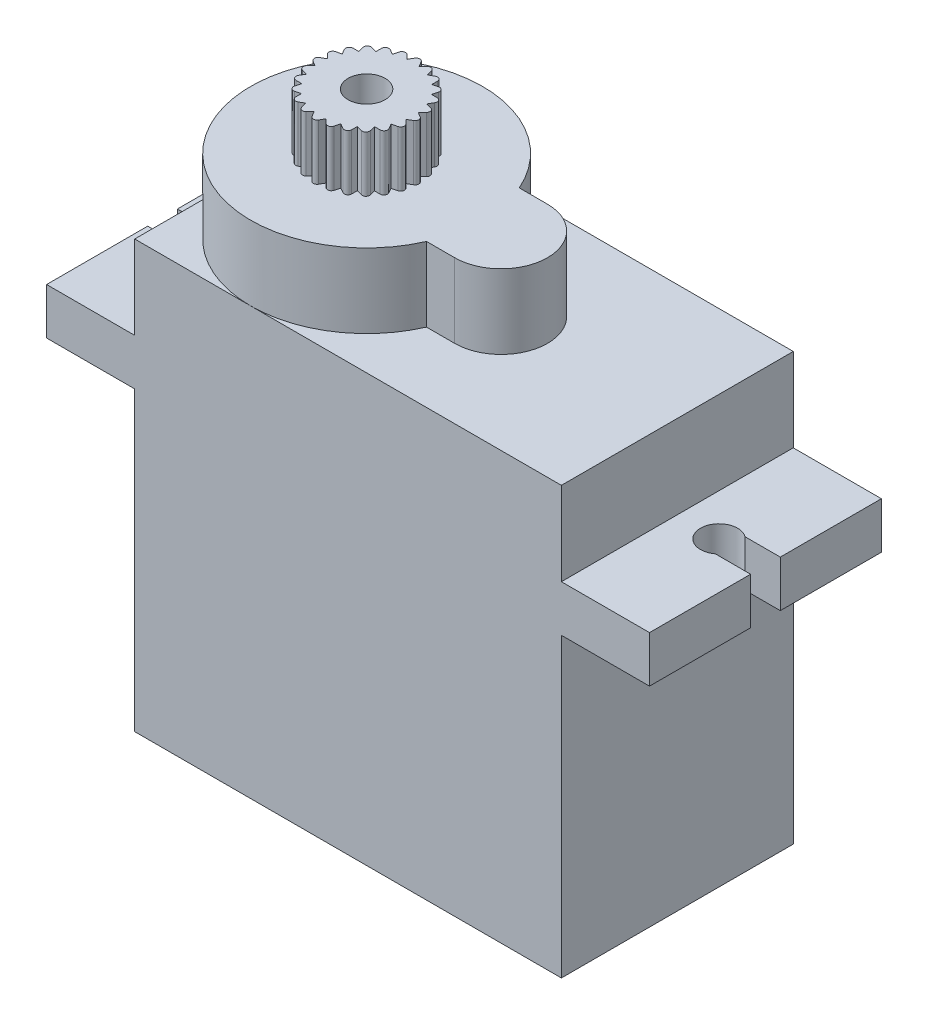
from build123d import *

# Parameters (mm, degrees)
RESSALTO_EXTRUS_O1_DEPTH = 12.5
CORTE_EXTRUS_O1_DEPTH    = 36.616885041
ESBO_O3_R                = 6.25
ESBO_O3_R_2              = 2.5
RESSALTO_EXTRUS_O3_DEPTH = 4
ESBO_O4_R                = 2.5
ESBO_O4_R_2              = 1
RESSALTO_EXTRUS_O4_DEPTH = 3
RESSALTO_EXTRUS_O5_DEPTH = 3
PADR_OCIRCULAR1_COUNT    = 24


with BuildPart() as part:
    # Esboço1 → Ressalto-extrusão1 (new body)
    with BuildSketch(Plane.XY):
        Polygon((0, 0), (0, 16), (-4.75, 16), (-4.75, 18.5), (0, 18.5), (0, 23), (23, 23), (23, 18.5), (27.75, 18.5), (27.75, 16), (23, 16), (23, 0), align=None)
    extrude(amount=RESSALTO_EXTRUS_O1_DEPTH)

    # Esboço2 → Corte-extrusão1 (cut, through all)
    with BuildSketch(Plane(origin=(0, 18.5, 0), x_dir=(1, 0, 0), z_dir=(0, 1, 0))):
        with BuildLine():
            ThreePointArc((-2.85, -7.05), (-3.25, -6.25), (-2.85, -5.45))
            Line((-2.85, -5.45), (-4.75, -5.45))
            Line((-4.75, -5.45), (-4.75, -7.05))
            Line((-4.75, -7.05), (-2.85, -7.05))
        make_face()
        with BuildLine():
            ThreePointArc((-1.25, -6.25), (-1.802786405, -5.355572809), (-2.85, -5.45))
            Line((-2.85, -5.45), (-2.85, -7.05))
            ThreePointArc((-2.85, -7.05), (-1.802786405, -7.144427191), (-1.25, -6.25))
        make_face()
        with BuildLine():
            Line((-2.85, -7.05), (-2.85, -5.45))
            ThreePointArc((-2.85, -5.45), (-3.25, -6.25), (-2.85, -7.05))
        make_face()
        with BuildLine():
            ThreePointArc((26.25, -6.25), (26.144427191, -5.802786405), (25.85, -5.45))
            Line((25.85, -5.45), (25.85, -7.05))
            ThreePointArc((25.85, -7.05), (26.144427191, -6.697213595), (26.25, -6.25))
        make_face()
        with BuildLine():
            Line((25.85, -7.05), (25.85, -5.45))
            ThreePointArc((25.85, -5.45), (24.25, -6.25), (25.85, -7.05))
        make_face()
        with BuildLine():
            Line((27.75, -5.45), (25.85, -5.45))
            ThreePointArc((25.85, -5.45), (26.144427191, -5.802786405), (26.25, -6.25))
            ThreePointArc((26.25, -6.25), (26.144427191, -6.697213595), (25.85, -7.05))
            Line((25.85, -7.05), (27.75, -7.05))
            Line((27.75, -7.05), (27.75, -5.45))
        make_face()
    extrude(amount=-CORTE_EXTRUS_O1_DEPTH, mode=Mode.SUBTRACT)

    # Esboço3 → Ressalto-extrusão3 (add)
    with BuildSketch(Plane(origin=(0, 23, 0), x_dir=(1, 0, 0), z_dir=(0, 1, 0))):
        with BuildLine():
            ThreePointArc((12.137931034, -4.153629772), (12.789692169, -3.8530305), (13.5, -3.75))
            Line((13.5, -3.75), (11.978219619, -3.75))
            ThreePointArc((11.978219619, -3.75), (12.061580529, -3.95042792), (12.137931034, -4.153629772))
        make_face()
        with BuildLine():
            Line((11.978219619, -8.75), (13.5, -8.75))
            ThreePointArc((13.5, -8.75), (12.789692169, -8.6469695), (12.137931034, -8.346370228))
            ThreePointArc((12.137931034, -8.346370228), (12.061580529, -8.54957208), (11.978219619, -8.75))
        make_face()
        with BuildLine():
            ThreePointArc((12.137931034, -8.346370228), (12.789692169, -8.6469695), (13.5, -8.75))
            Line((13.5, -8.75), (13.5, -3.75))
            ThreePointArc((13.5, -3.75), (12.789692169, -3.8530305), (12.137931034, -4.153629772))
            ThreePointArc((12.137931034, -4.153629772), (12.408817621, -5.186296321), (12.5, -6.25))
            ThreePointArc((12.5, -6.25), (12.408817621, -7.313703679), (12.137931034, -8.346370228))
        make_face()
        with BuildLine():
            Line((13.5, -3.75), (13.5, -8.75))
            ThreePointArc((13.5, -8.75), (15.267766953, -8.017766953), (16, -6.25))
            ThreePointArc((16, -6.25), (15.267766953, -4.482233047), (13.5, -3.75))
        make_face()
        with Locations((6.25, -6.25)):
            Circle(ESBO_O3_R)
        with Locations((13.5, -6.25)):
            Circle(ESBO_O3_R_2)
        with BuildLine():
            Line((8.733610526, -8.75), (11.978219619, -8.75))
            ThreePointArc((11.978219619, -8.75), (12.061580529, -8.54957208), (12.137931034, -8.346370228))
            ThreePointArc((12.137931034, -8.346370228), (11, -6.25), (12.137931034, -4.153629772))
            ThreePointArc((12.137931034, -4.153629772), (12.061580529, -3.95042792), (11.978219619, -3.75))
            Line((11.978219619, -3.75), (8.733610526, -3.75))
            Line((8.733610526, -3.75), (8.733610526, -8.75))
        make_face()
        with BuildLine():
            ThreePointArc((11.978219619, -3.75), (0, -6.25), (11.978219619, -8.75))
            Line((11.978219619, -8.75), (8.733610526, -8.75))
            Line((8.733610526, -8.75), (8.733610526, -3.75))
            Line((8.733610526, -3.75), (11.978219619, -3.75))
        make_face()
    extrude(amount=RESSALTO_EXTRUS_O3_DEPTH)

    # Esboço4 → Ressalto-extrusão4 (add)
    with BuildSketch(Plane(origin=(0, 27, 0), x_dir=(1, 0, 0), z_dir=(0, 1, 0))):
        with Locations(Location((6.25, -6.25, 0), (0, 0, 270))):
            Circle(ESBO_O4_R)
        with Locations(Location((6.25, -6.25, 0), (0, 0, 270))):
            Circle(ESBO_O4_R_2, mode=Mode.SUBTRACT)
    extrude(amount=RESSALTO_EXTRUS_O4_DEPTH)

    # Esboço5 → Ressalto-extrusão5 (add)
    with BuildSketch(Plane(origin=(0, 30, 0), x_dir=(1, 0, 0), z_dir=(0, 1, 0))):
        with BuildLine():
            Line((5.952990595, -3.767705615), (6.103919204, -3.507984418))
            ThreePointArc((6.103919204, -3.507984418), (6.277405699, -3.408473433), (6.450327987, -3.508961652))
            Line((6.450327987, -3.508961652), (6.602949214, -3.77504003))
            Line((6.602949214, -3.77504003), (5.952990595, -3.767705615))
        make_face()
    ressalto_extrus_o5 = extrude(amount=-RESSALTO_EXTRUS_O5_DEPTH)

    # PadrãoCircular1: Ressalto-extrusão5 ×24 about axis
    padr_ocircular1_axis = Axis((6.25, 0, 6.25), (0, 1, 0))
    for i in range(1, PADR_OCIRCULAR1_COUNT):
        add(ressalto_extrus_o5.rotate(padr_ocircular1_axis, i * 360 / PADR_OCIRCULAR1_COUNT))


solid = part.part
